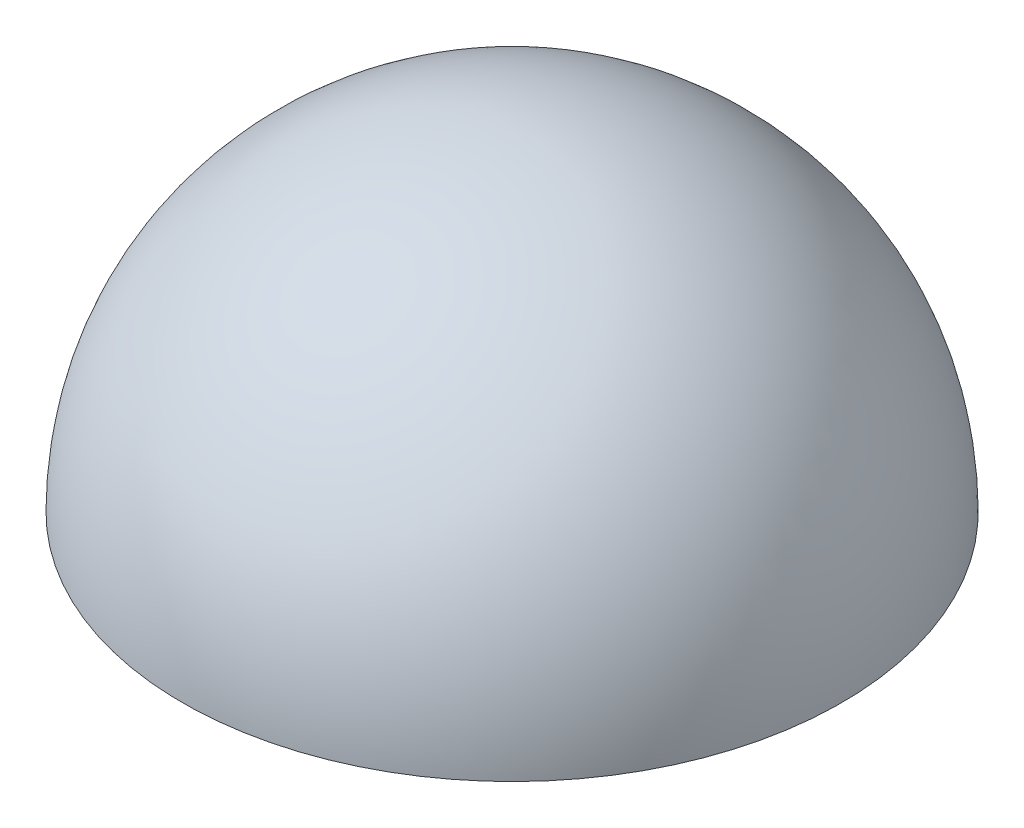
from build123d import *

# Parameters (mm, degrees)
REVOLVE1_ANGLE = 180


with BuildPart() as part:
    # Sketch1 → Revolve1 (revolve)
    with BuildSketch(Plane(origin=(0, 0, 0), x_dir=(1, 0, 0), z_dir=(0, 1, 0))):
        with BuildLine():
            Line((-33.5, 0), (33.5, 0))
            ThreePointArc((33.5, 0), (0, 33.5), (-33.5, 0))
        make_face()
    revolve(axis=Axis((-47.186182054, 0, 0), (1, 0, 0)), revolution_arc=REVOLVE1_ANGLE)


solid = part.part
